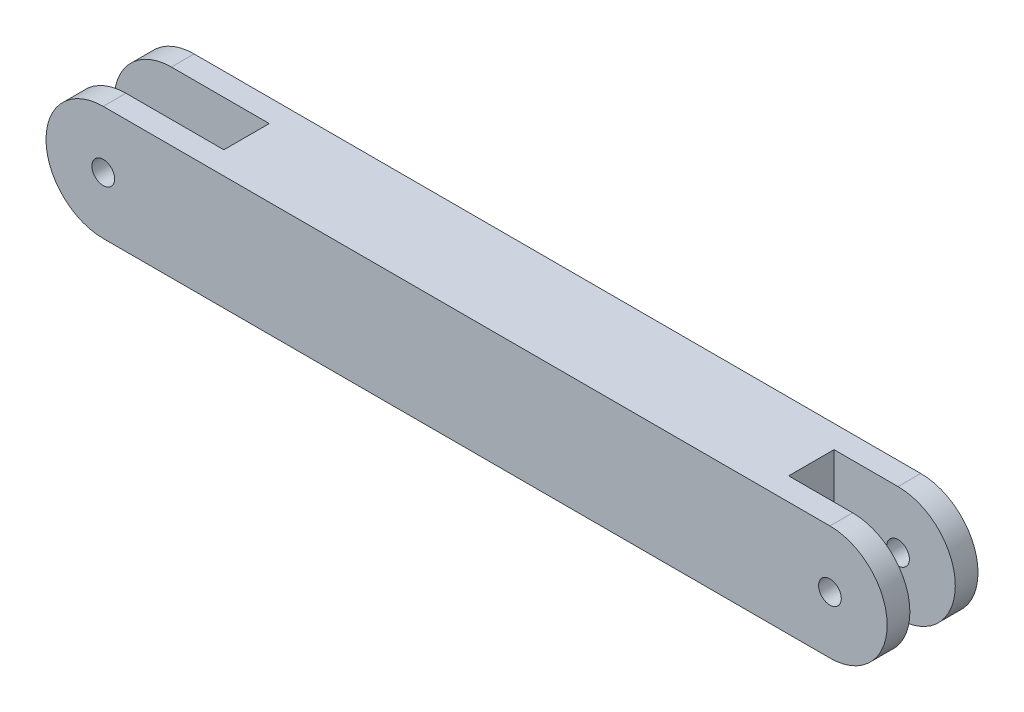
from build123d import *

# Parameters (mm, degrees)
SKETCH1_R           = 3.175
BOSS_EXTRUDE1_DEPTH = 6.35
SKETCH2_W           = 168.075192403
SKETCH2_H           = 32.004
BOSS_EXTRUDE2_DEPTH = 12.7
SKETCH5_R           = 3.175
BOSS_EXTRUDE3_DEPTH = 6.35
SKETCH7_W           = 12.7
SKETCH7_H           = 32.004
CUT_EXTRUDE1_DEPTH  = 10.16


with BuildPart() as part:
    # Sketch1 → Boss-Extrude1 (new body)
    with BuildSketch(Plane.XY):
        with BuildLine():
            Line((-47.217391304, 7.923913043), (155.982608696, 7.923913043))
            ThreePointArc((155.982608696, 7.923913043), (171.984608696, -8.078086957), (155.982608696, -24.080086957))
            Line((155.982608696, -24.080086957), (-47.217391304, -24.080086957))
            ThreePointArc((-47.217391304, -24.080086957), (-63.219391304, -8.078086957), (-47.217391304, 7.923913043))
        make_face()
        with Locations((-47.217391304, -8.078086957)):
            Circle(SKETCH1_R, mode=Mode.SUBTRACT)
        with Locations((155.982608696, -8.078086957)):
            Circle(SKETCH1_R, mode=Mode.SUBTRACT)
    extrude(amount=BOSS_EXTRUDE1_DEPTH)

    # Sketch2 → Boss-Extrude2 (add)
    with BuildSketch(Plane.XY.offset(6.35)):
        with Locations((54.045012495, -8.078086957)):
            Rectangle(SKETCH2_W, SKETCH2_H)
    extrude(amount=BOSS_EXTRUDE2_DEPTH)

    # Sketch5 → Boss-Extrude3 (add)
    with BuildSketch(Plane.XY.offset(19.05)):
        with BuildLine():
            Line((-47.217391304, 7.923913043), (155.982608696, 7.923913043))
            ThreePointArc((155.982608696, 7.923913043), (171.984608696, -8.078086957), (155.982608696, -24.080086957))
            Line((155.982608696, -24.080086957), (-47.217391304, -24.080086957))
            ThreePointArc((-47.217391304, -24.080086957), (-63.219391304, -8.078086957), (-47.217391304, 7.923913043))
        make_face()
        with Locations((-47.217391304, -8.078086957)):
            Circle(SKETCH5_R, mode=Mode.SUBTRACT)
        with Locations((155.982608696, -8.078086957)):
            Circle(SKETCH5_R, mode=Mode.SUBTRACT)
    extrude(amount=BOSS_EXTRUDE3_DEPTH)

    # Sketch7 → Cut-Extrude1 (cut)
    with BuildSketch(Plane.ZY.offset(29.992583707)):
        with Locations((12.7, -8.078086957)):
            Rectangle(SKETCH7_W, SKETCH7_H)
    extrude(amount=-CUT_EXTRUDE1_DEPTH, mode=Mode.SUBTRACT)


solid = part.part
